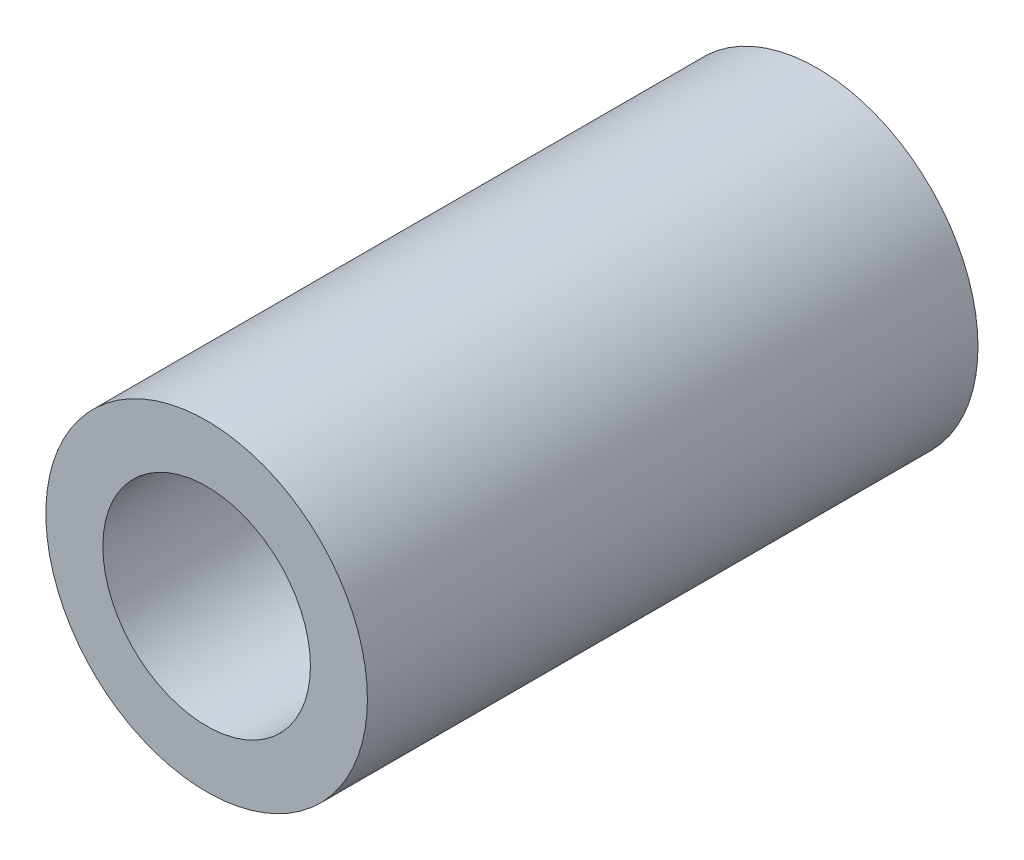
from build123d import *

# Parameters (mm, degrees)
SKETCH_1_R      = 3.95
SKETCH_1_R_2    = 2.55
EXTRUDE_1_DEPTH = 7
EXTRUDE_START   = -8
SKETCH_1_3_R    = 3.95
SKETCH_1_3_R_2  = 2.7
EXTRUDE_2_DEPTH = 8


with BuildPart() as part:
    # 草图1 → 凸台-拉伸1 (new body)
    with BuildSketch(Plane.XY):
        Circle(SKETCH_1_R)
        Circle(SKETCH_1_R_2, mode=Mode.SUBTRACT)
    extrude(amount=EXTRUDE_1_DEPTH)

    # 草图1<3> → 凸台-拉伸2 (add)
    with BuildSketch(Plane.XY.offset(EXTRUDE_START)):
        Circle(SKETCH_1_3_R)
        Circle(SKETCH_1_3_R_2, mode=Mode.SUBTRACT)
    extrude(amount=EXTRUDE_2_DEPTH)


solid = part.part
